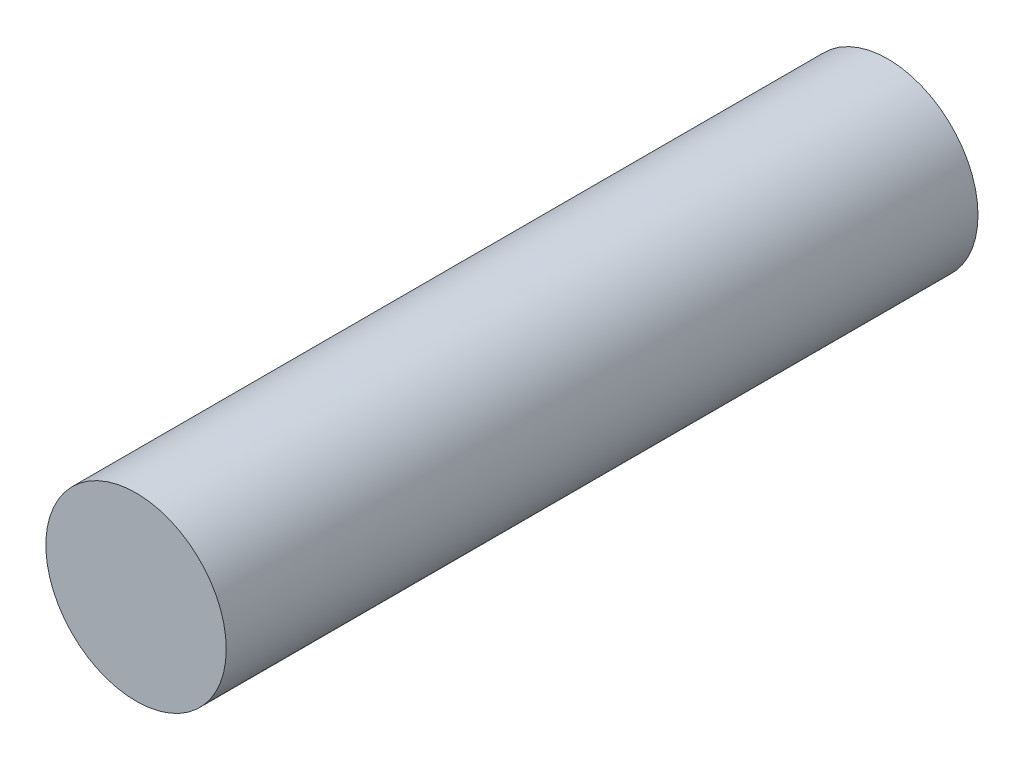
from build123d import *

# Parameters (mm, degrees)
SKETCH1_R           = 1.5
BOSS_EXTRUDE1_DEPTH = 12.5


with BuildPart() as part:
    # Sketch1 → Boss-Extrude1 (new body)
    with BuildSketch(Plane.XY):
        Circle(SKETCH1_R)
    extrude(amount=BOSS_EXTRUDE1_DEPTH)


solid = part.part
